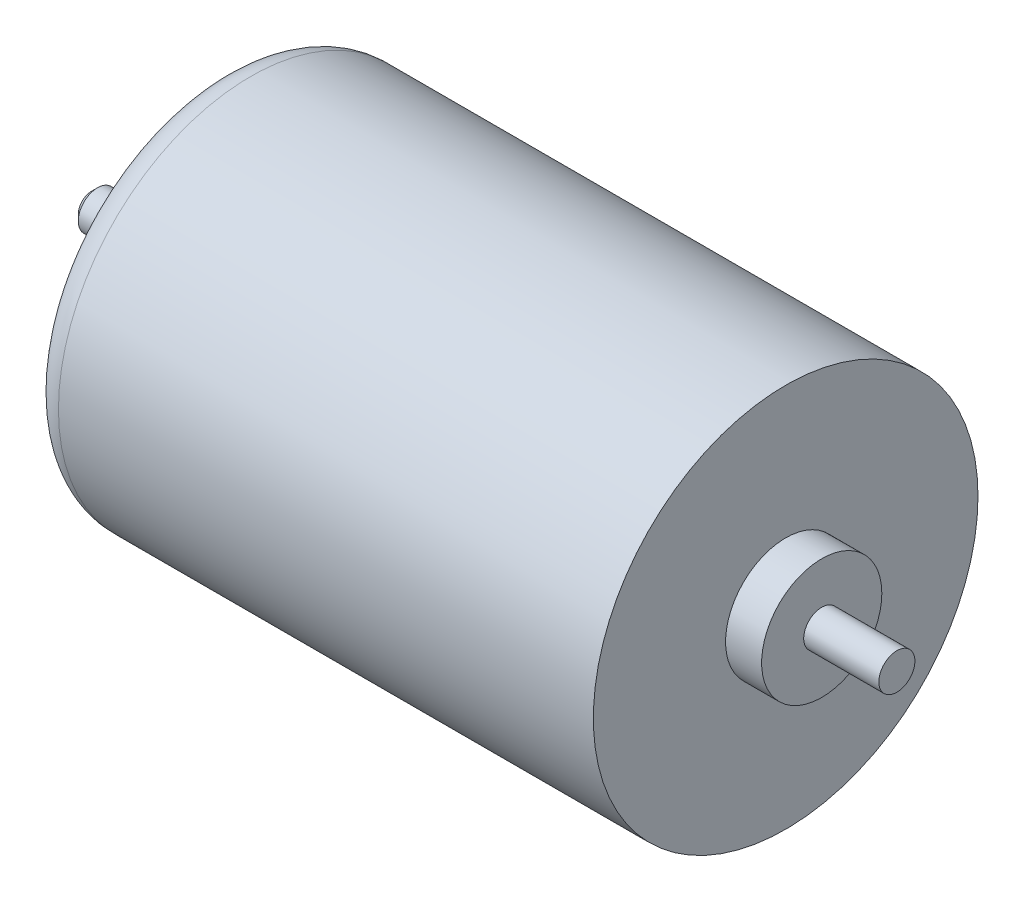
from build123d import *

# Parameters (mm, degrees)
REDONDEO1_R                   = 2.5
TALADRO_ROSCADO_M3X0_51_D     = 2.5
TALADRO_ROSCADO_M3X0_51_DEPTH = 8.5
TALADRO_ROSCADO_M3X0_51_TIP   = 0.751075774
CHAFL_N1_SIZE                 = 0.5


with BuildPart() as part:
    # Croquis1 → Revolución1 (revolve)
    with BuildSketch(Plane(origin=(0, 0, 0), x_dir=(0, 1, 0), z_dir=(0, 0, 1)), mode=Mode.PRIVATE) as revoluci_n1_sk:
        Polygon((0, 0), (1.5, 0), (1.5, 6.25), (5, 6.25), (5, 9.25), (16, 9.25), (16, 56.25), (5, 56.25), (5, 59.85), (1.6, 59.85), (1.6, 67), (0, 67), align=None)
    revolve(revoluci_n1_sk.sketch.rotate(Axis((0, 0, 0), (-1, 0, 0)), 90), axis=Axis((0, 0, 0), (-1, 0, 0)))

    # Redondeo1
    redondeo1_edges = [part.edges().sort_by_distance(p)[0] for p in [
        (-56.25, 0, 16),
    ]]
    fillet(redondeo1_edges, radius=REDONDEO1_R)

    # Taladro roscado M3x0.51
    with Locations(Plane(origin=(-56.25, 0, 0), x_dir=(0, -1, 0), z_dir=(-1, 0, 0))):
        with Locations((-10.3, 0), (10.3, 0)):
            Hole(TALADRO_ROSCADO_M3X0_51_D / 2, depth=TALADRO_ROSCADO_M3X0_51_DEPTH)
            with Locations((0, 0, -(TALADRO_ROSCADO_M3X0_51_DEPTH + TALADRO_ROSCADO_M3X0_51_TIP / 2))):  # 118° drill point
                Cone(0, TALADRO_ROSCADO_M3X0_51_D / 2, TALADRO_ROSCADO_M3X0_51_TIP, mode=Mode.SUBTRACT)

    # Chaflán1
    chafl_n1_edges = [part.edges().sort_by_distance(p)[0] for p in [
        (-67, 0, 1.6),
    ]]
    chamfer(chafl_n1_edges, length=CHAFL_N1_SIZE)


solid = part.part
